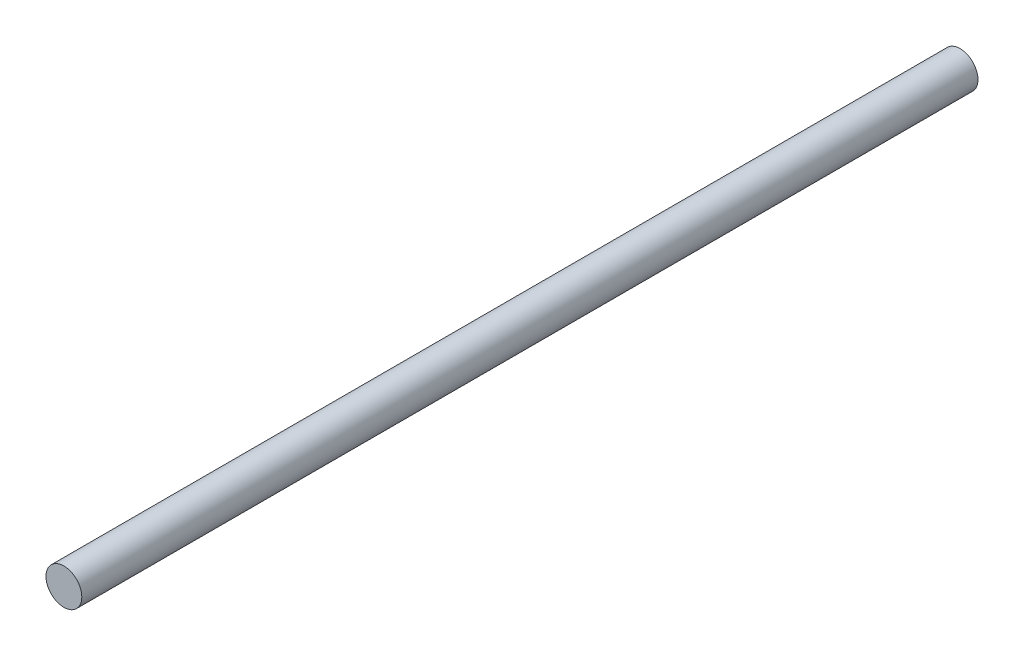
from build123d import *

# Parameters (mm, degrees)
ESQUISSE1_R        = 2
BOSS_EXTRU_1_DEPTH = 100


with BuildPart() as part:
    # Esquisse1 → Boss.-Extru.1 (new body)
    with BuildSketch(Plane.XY):
        Circle(ESQUISSE1_R)
    extrude(amount=BOSS_EXTRU_1_DEPTH)


solid = part.part
